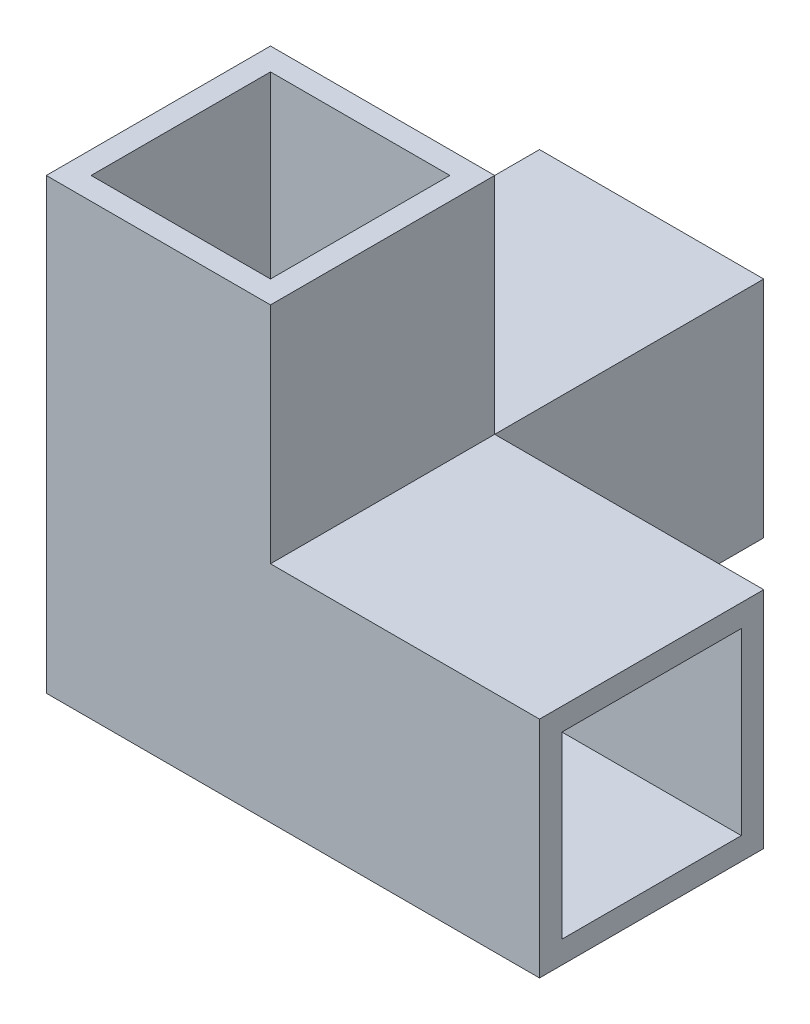
from build123d import *

# Parameters (mm, degrees)
BOSS_EXTRUDE1_DEPTH = 25
SKETCH3_W           = 25
SKETCH3_H           = 25
BOSS_EXTRUDE2_DEPTH = 25
SHELL2_T            = -2.5


with BuildPart() as part:
    # Sketch2 → Boss-Extrude1 (new body)
    with BuildSketch(Plane(origin=(0, 0, 0), x_dir=(1, 0, 0), z_dir=(0, 1, 0))):
        Polygon((0, 0), (30, 0), (30, -25), (-25, -25), (-25, 30), (0, 30), align=None)
    extrude(amount=BOSS_EXTRUDE1_DEPTH)

    # Sketch3 → Boss-Extrude2 (add)
    with BuildSketch(Plane(origin=(0, 25, 0), x_dir=(1, 0, 0), z_dir=(0, 1, 0))):
        with Locations((-12.5, -12.5)):
            Rectangle(SKETCH3_W, SKETCH3_H)
    extrude(amount=BOSS_EXTRUDE2_DEPTH)

    # Shell2
    shell2_openings = [part.faces().sort_by_distance(p)[0] for p in [
        (30, 12.5, 12.5),
        (-12.5, 12.5, -30),
        (-12.5, 50, 12.5),
    ]]
    offset(amount=SHELL2_T, openings=shell2_openings, kind=Kind.INTERSECTION)


solid = part.part
